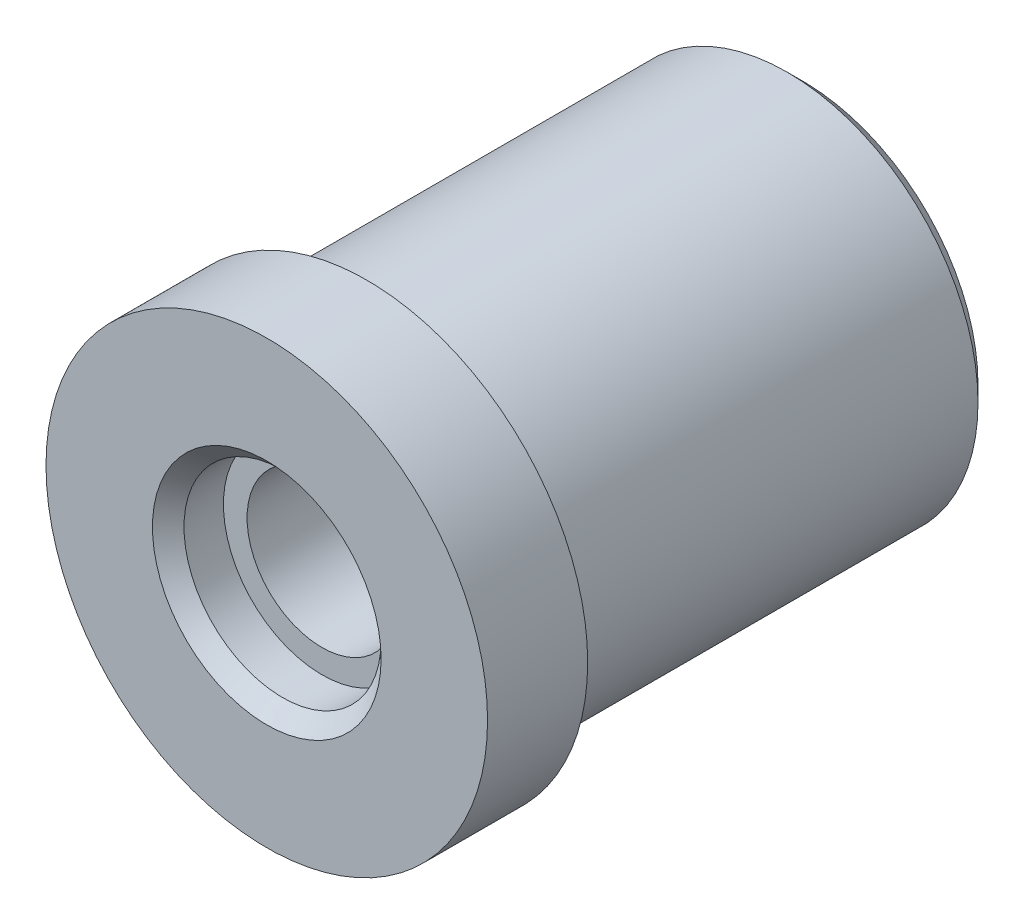
from build123d import *

# Parameters (mm, degrees)
SKETCH1_R           = 12.1
BOSS_EXTRUDE1_DEPTH = 17
SKETCH2_R           = 4.75
CUT_EXTRUDE1_DEPTH  = 39.063368217
SKETCH3_R           = 6.25
CUT_EXTRUDE2_DEPTH  = 3.5
SKETCH4_R           = 14
SKETCH4_R_2         = 12.1
SKETCH4_R_3         = 6.25
BOSS_EXTRUDE2_DEPTH = 6.35
CHAMFER1_SIZE       = 1


with BuildPart() as part:
    # Sketch1 → Boss-Extrude1 (new, symmetric)
    with BuildSketch(Plane.XY):
        Circle(SKETCH1_R)
    extrude(amount=BOSS_EXTRUDE1_DEPTH, both=True)

    # Sketch2 → Cut-Extrude1 (cut, through all)
    with BuildSketch(Plane.XY.offset(17)):
        Circle(SKETCH2_R)
    extrude(amount=-CUT_EXTRUDE1_DEPTH, mode=Mode.SUBTRACT)

    # Sketch3 → Cut-Extrude2 (cut)
    with BuildSketch(Plane.XY.offset(17)):
        Circle(SKETCH3_R)
    cut_extrude2 = extrude(amount=-CUT_EXTRUDE2_DEPTH, mode=Mode.SUBTRACT)

    # Mirror1: Cut-Extrude2 across plane
    add(cut_extrude2.mirror(Plane.XY), mode=Mode.SUBTRACT)

    # Sketch4 → Boss-Extrude2 (add)
    # profile 1 of 2: a face of its own
    with BuildSketch(Plane.XY.offset(17)):
        Circle(SKETCH4_R)
        Circle(SKETCH4_R_2, mode=Mode.SUBTRACT)
    # profile 2 of 2: a face of its own
    with BuildSketch(Plane.XY.offset(17)):
        Circle(SKETCH4_R_2)
        Circle(SKETCH4_R_3, mode=Mode.SUBTRACT)
    extrude(amount=-BOSS_EXTRUDE2_DEPTH)

    # Chamfer1
    chamfer1_edges = [part.edges().sort_by_distance(p)[0] for p in [
        (-6.25, 0, 17),
        (-6.25, 0, -17),
        (-12.1, 0, -17),
    ]]
    chamfer(chamfer1_edges, length=CHAMFER1_SIZE)


solid = part.part
